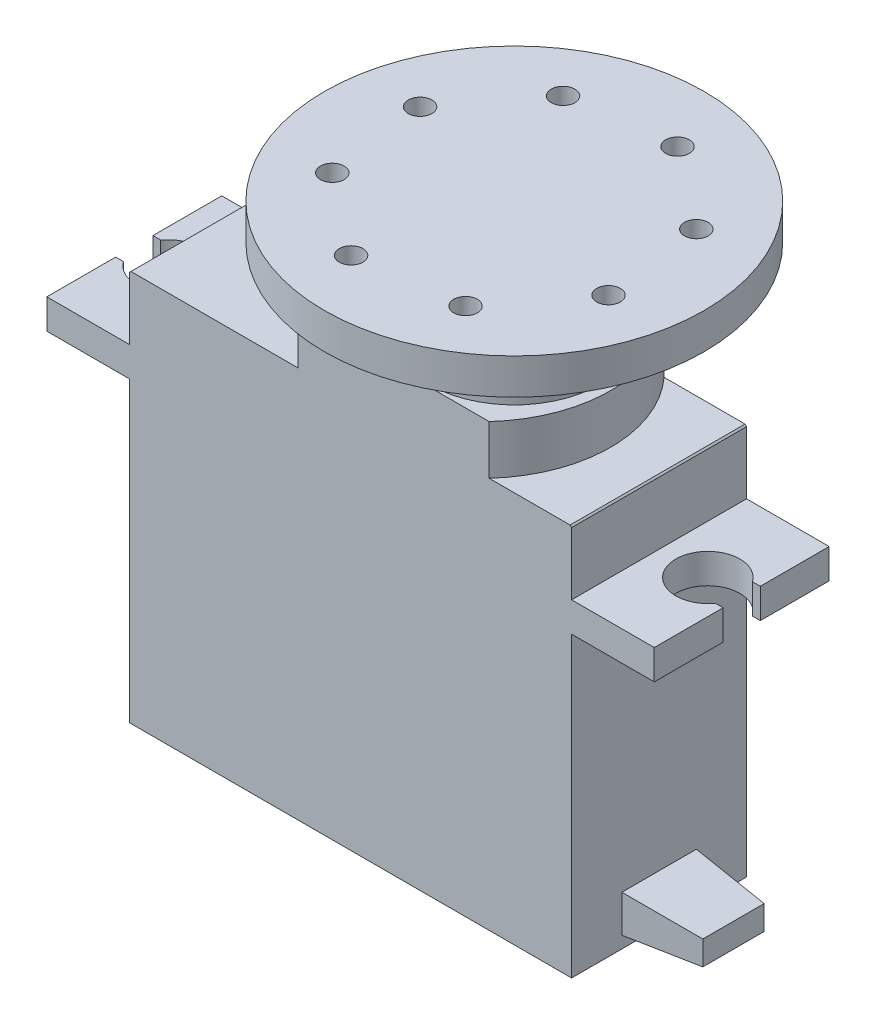
from build123d import *

# Parameters (mm, degrees)
BOSS_EXTRUDE1_DEPTH   = 5.875
CUT_EXTRUDE1_REACH    = 32.572
SKETCH3_R             = 3.96875
BOSS_EXTRUDE2_DEPTH   = 13
SKETCH5_W             = 5
SKETCH5_H             = 2.5
BOSS_EXTRUDE4_DEPTH   = 5
BOSS_EXTRUDE4_TAPER   = 5
SKETCH6_R             = 3.96875
BOSS_EXTRUDE5_DEPTH   = 3.3
SKETCH7_R             = 5.75
BOSS_EXTRUDE6_DEPTH   = 1.8
SKETCH4_R             = 12.75
SKETCH4_R_2           = 0.79375
BOSS_EXTRUDE3_DEPTH   = 2.4
BODY_MOVE_COPY1_ANGLE = 30


with BuildPart() as part:
    # Sketch1 → Boss-Extrude1 (new, symmetric)
    with BuildSketch(Plane.XY):
        Polygon((-20.4, 2), (-20.4, 0), (-14.85, 0), (-14.85, -20), (14.85, -20), (14.85, 0), (20.4, 0), (20.4, 2), (14.85, 2), (14.85, 6.2), (14.75, 6.3), (-14.75, 6.3), (-14.85, 6.2), (-14.85, 2), align=None)
    extrude(amount=BOSS_EXTRUDE1_DEPTH, both=True)

    # Sketch2 → Cut-Extrude1 (cut, up to next)
    with BuildSketch(Plane(origin=(0, 2, 0), x_dir=(1, 0, 0), z_dir=(0, 1, 0)), mode=Mode.PRIVATE) as cut_extrude1_sk1:
        with BuildLine():
            Line((-20.4, 1.25), (-19.874285568, 1.25))
            ThreePointArc((-19.874285568, 1.25), (-15.975, 0), (-19.874285568, -1.25))
            Line((-19.874285568, -1.25), (-20.4, -1.25))
            Line((-20.4, -1.25), (-20.4, 1.25))
        make_face()
    cut_extrude1_tool1 = extrude(cut_extrude1_sk1.sketch, amount=-CUT_EXTRUDE1_REACH, mode=Mode.PRIVATE) & part.part
    # Sketch2 → Cut-Extrude1 (cut, up to next)
    with BuildSketch(Plane(origin=(0, 2, 0), x_dir=(1, 0, 0), z_dir=(0, 1, 0)), mode=Mode.PRIVATE) as cut_extrude1_sk2:
        with BuildLine():
            Line((20.4, 1.25), (20.4, -1.25))
            Line((20.4, -1.25), (19.874285568, -1.25))
            ThreePointArc((19.874285568, -1.25), (15.975, 0), (19.874285568, 1.25))
            Line((19.874285568, 1.25), (20.4, 1.25))
        make_face()
    cut_extrude1_tool2 = extrude(cut_extrude1_sk2.sketch, amount=-CUT_EXTRUDE1_REACH, mode=Mode.PRIVATE) & part.part
    add(cut_extrude1_tool1.solids().sort_by_distance((-18.213582, 2, 0))[0], mode=Mode.SUBTRACT)
    add(cut_extrude1_tool2.solids().sort_by_distance((18.213582, 2, 0))[0], mode=Mode.SUBTRACT)

    # Sketch3 → Boss-Extrude2 (add)
    with BuildSketch(Plane(origin=(0, 2, 0), x_dir=(1, 0, 0), z_dir=(0, 1, 0))):
        with Locations((5.125, 0)):
            Circle(SKETCH3_R)
    extrude(amount=BOSS_EXTRUDE2_DEPTH)

    # Sketch5 → Boss-Extrude4 (add)
    with BuildSketch(Plane(origin=(14.85, 0, 0), x_dir=(0, 0, -1), z_dir=(1, 0, 0))):
        with Locations((0, -17.95)):
            Rectangle(SKETCH5_W, SKETCH5_H)
    extrude(amount=BOSS_EXTRUDE4_DEPTH, taper=BOSS_EXTRUDE4_TAPER)

    # Sketch6 → Boss-Extrude5 (add)
    with BuildSketch(Plane(origin=(0, 6.3, 0), x_dir=(1, 0, 0), z_dir=(0, 1, 0))):
        with BuildLine():
            ThreePointArc((9.31047619, -5.875), (11.002865792, -3.151545823), (11.59375, 0))
            ThreePointArc((11.59375, 0), (11.002865792, 3.151545823), (9.31047619, 5.875))
            Line((9.31047619, 5.875), (-3.52297619, 5.875))
            ThreePointArc((-3.52297619, 5.875), (-5.80625, 0), (-3.52297619, -5.875))
            Line((-3.52297619, -5.875), (9.31047619, -5.875))
        make_face()
        with Locations((5.125, 0)):
            Circle(SKETCH6_R, mode=Mode.SUBTRACT)
    extrude(amount=BOSS_EXTRUDE5_DEPTH)

    # Sketch7 → Boss-Extrude6 (add)
    with BuildSketch(Plane(origin=(0, 9.6, 0), x_dir=(1, 0, 0), z_dir=(0, 1, 0))):
        with Locations(Location((5.125, 0, 0), (0, 0, 270))):
            Circle(SKETCH7_R)
    extrude(amount=BOSS_EXTRUDE6_DEPTH)


with BuildPart() as body_2:
    # Sketch4 → Boss-Extrude3 (new body)
    with BuildSketch(Plane(origin=(0, 15, 0), x_dir=(1, 0, 0), z_dir=(0, 1, 0))):
        with Locations(Location((5.125, 0, 0), (0, 0, 180))):
            Circle(SKETCH4_R)
        with Locations(Location((14.075, 0, 0), (0, 0, 180))):
            Circle(SKETCH4_R_2, mode=Mode.SUBTRACT)
        with Locations(Location((11.453605692, 6.328605692, 0), (0, 0, 180))):
            Circle(SKETCH4_R_2, mode=Mode.SUBTRACT)
        with Locations(Location((5.125, 8.95, 0), (0, 0, 180))):
            Circle(SKETCH4_R_2, mode=Mode.SUBTRACT)
        with Locations(Location((-3.825, 0, 0), (0, 0, 180))):
            Circle(SKETCH4_R_2, mode=Mode.SUBTRACT)
        with Locations(Location((-1.203605692, -6.328605692, 0), (0, 0, 180))):
            Circle(SKETCH4_R_2, mode=Mode.SUBTRACT)
        with Locations(Location((5.125, -8.95, 0), (0, 0, 180))):
            Circle(SKETCH4_R_2, mode=Mode.SUBTRACT)
        with Locations(Location((11.453605692, -6.328605692, 0), (0, 0, 180))):
            Circle(SKETCH4_R_2, mode=Mode.SUBTRACT)
        with Locations(Location((-1.203605692, 6.328605692, 0), (0, 0, 180))):
            Circle(SKETCH4_R_2, mode=Mode.SUBTRACT)
    extrude(amount=BOSS_EXTRUDE3_DEPTH)


with BuildPart() as body_2_1:
    # Body-Move/Copy1: moved
    add(body_2.part.rotate(Axis((5.125, 0, 0), (0, 1, 0)), BODY_MOVE_COPY1_ANGLE))


solid = Compound([part.part, body_2_1.part])
